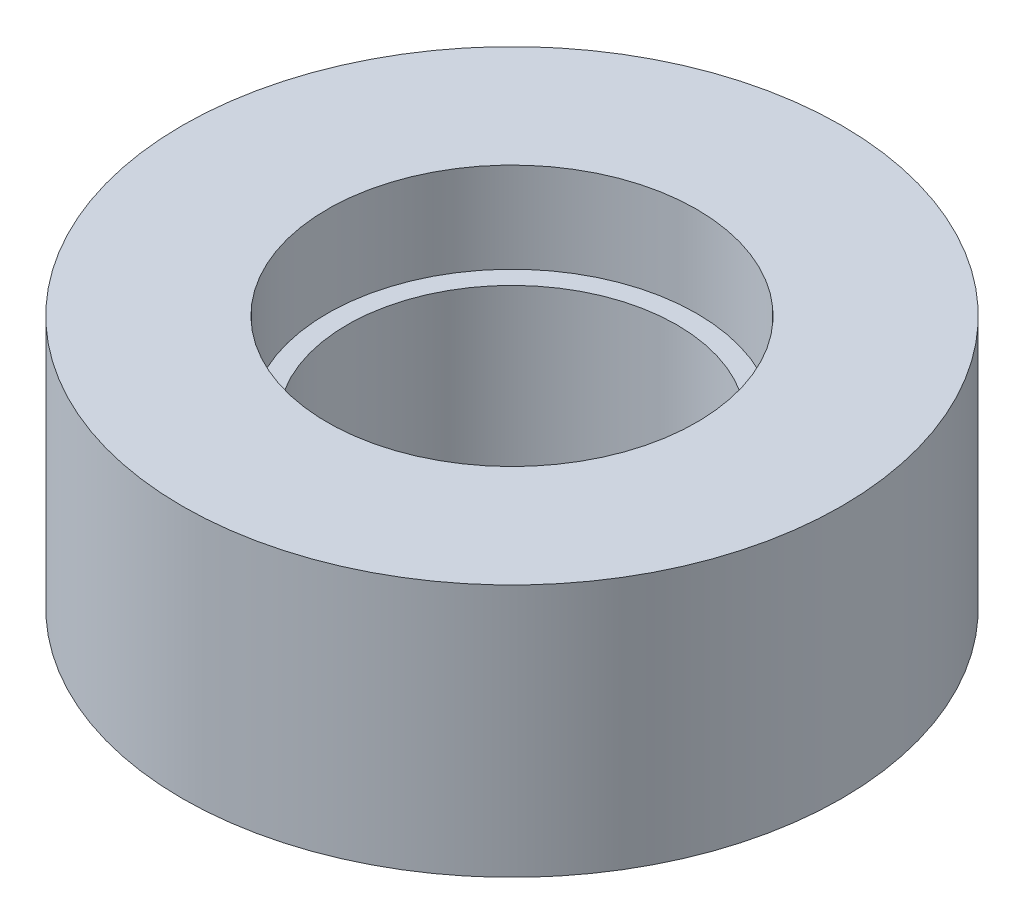
from build123d import *


with BuildPart() as part:
    # Sketch1 → Revolve1 (revolve)
    with BuildSketch(Plane(origin=(0, 0, 0), x_dir=(0, 0, -1), z_dir=(1, 0, 0)), mode=Mode.PRIVATE) as revolve1_sk:
        Polygon((-8.89, 12.192), (-8.89, 7.8486), (-7.9375, 7.8486), (-7.9375, 0), (-15.875, 0), (-15.875, 12.192), align=None)
    revolve(revolve1_sk.sketch.rotate(Axis((0, 0, 0), (0, 1, 0)), 180), axis=Axis((0, 0, 0), (0, 1, 0)))


solid = part.part
